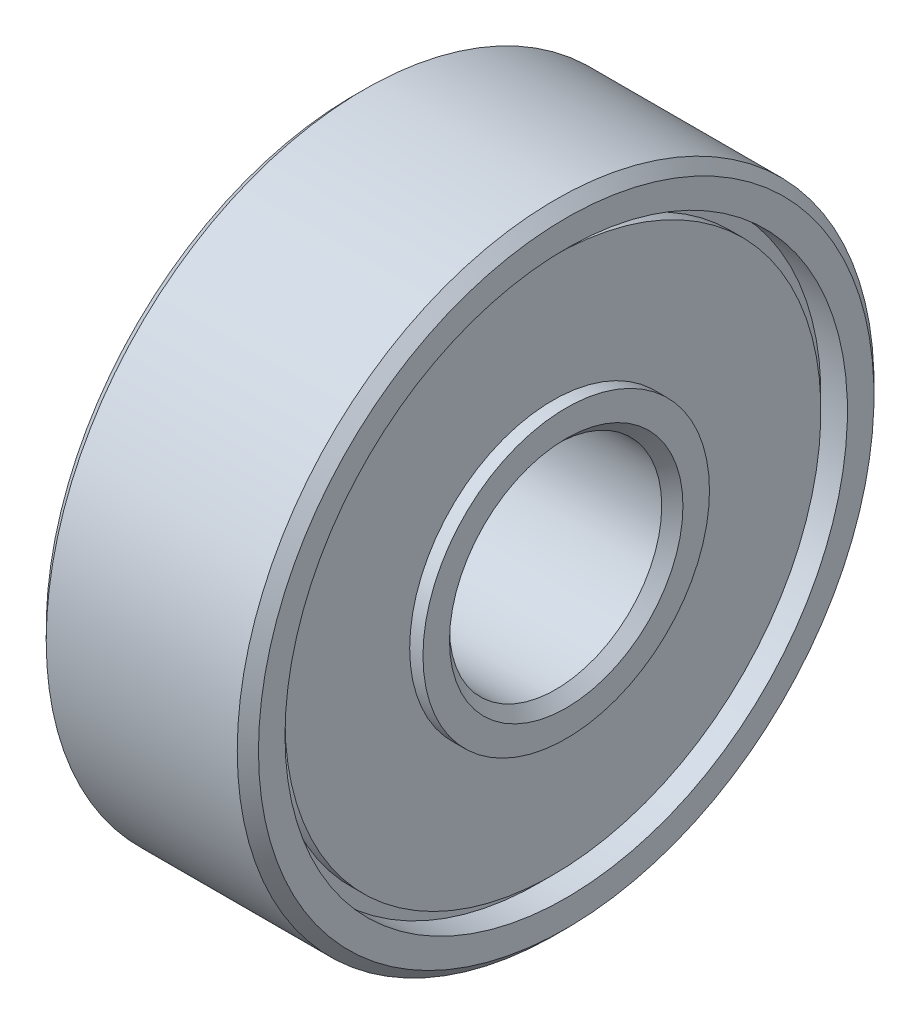
from build123d import *

# Parameters (mm, degrees)
CHAMFER_1_SIZE = 0.2


with BuildPart() as part:
    # 草图1 → 旋转1 (revolve)
    with BuildSketch(Plane.XY, mode=Mode.PRIVATE) as revolve_1_sk:
        Polygon((-2, 2), (2, 2), (2, 2.7), (1.75, 2.7), (1.75, 5.05), (1.5, 5.05), (1.5, 5.3), (2, 5.3), (2, 6), (-2, 6), (-2, 5.3), (-1.5, 5.3), (-1.5, 5.05), (-1.75, 5.05), (-1.75, 2.7), (-2, 2.7), align=None)
    revolve(revolve_1_sk.sketch.rotate(Axis((-3.90102381, 0, 0), (1, 0, 0)), 90), axis=Axis((-3.90102381, 0, 0), (1, 0, 0)))

    # 倒角1
    chamfer_1_edges = [part.edges().sort_by_distance(p)[0] for p in [
        (-2, 0, -6),
        (2, 0, -6),
        (2, 0, -2),
        (-2, 0, -2),
    ]]
    chamfer(chamfer_1_edges, length=CHAMFER_1_SIZE)


solid = part.part
